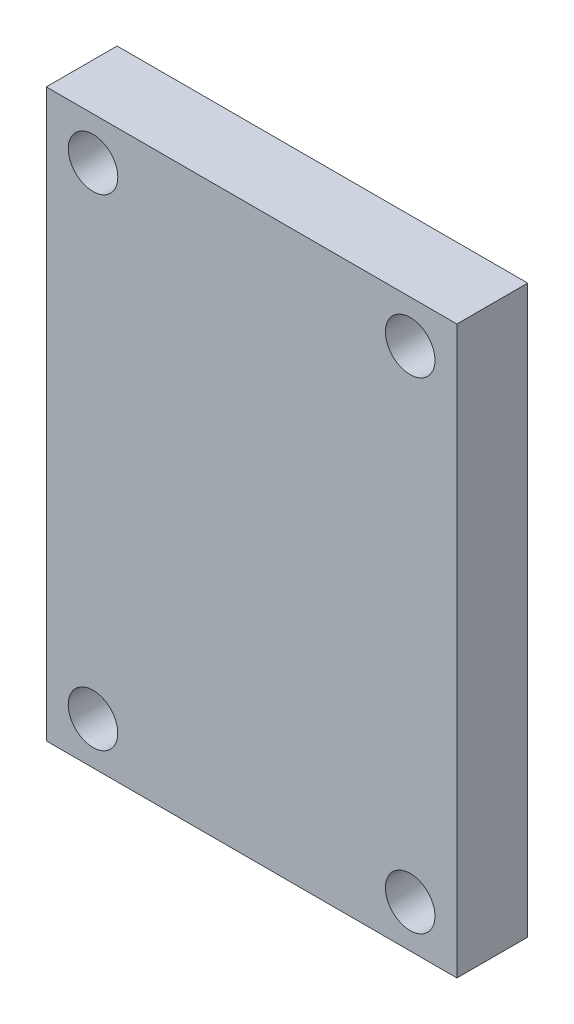
from build123d import *

# Parameters (mm, degrees)
SKETCH_1_W      = 29
SKETCH_1_H      = 40
SKETCH_1_R      = 1.75
EXTRUDE_1_DEPTH = 5


with BuildPart() as part:
    # 스케치1 → 보스-돌출1 (new body)
    with BuildSketch(Plane.XY):
        Rectangle(SKETCH_1_W, SKETCH_1_H)
        with Locations((11.199423754, 17)):
            Circle(SKETCH_1_R, mode=Mode.SUBTRACT)
        with Locations((-11.199423754, 17)):
            Circle(SKETCH_1_R, mode=Mode.SUBTRACT)
        with Locations(Location((11.199423754, -17, 0), (0, 0, 180))):
            Circle(SKETCH_1_R, mode=Mode.SUBTRACT)
        with Locations(Location((-11.199423754, -17, 0), (0, 0, 180))):
            Circle(SKETCH_1_R, mode=Mode.SUBTRACT)
    extrude(amount=EXTRUDE_1_DEPTH)


solid = part.part
